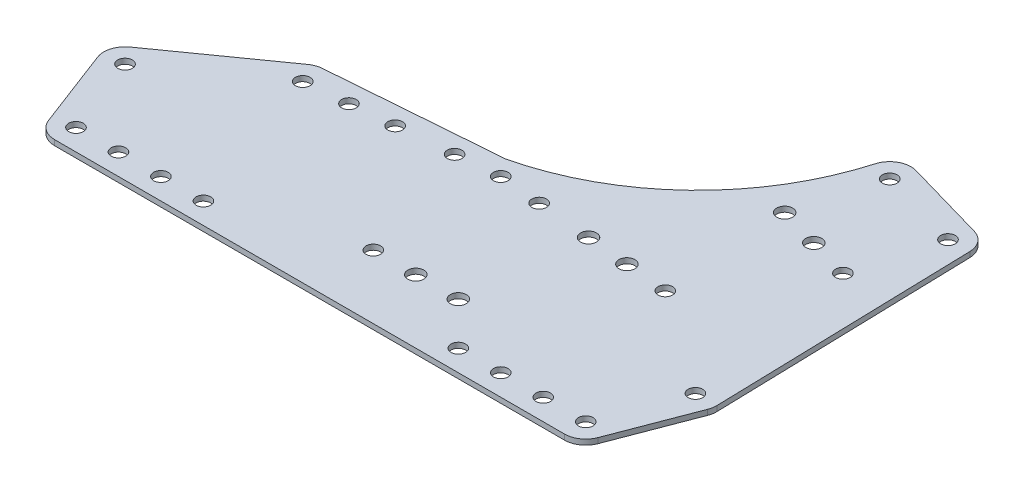
from build123d import *

# Parameters (mm, degrees)
SKETCH1_R           = 2.1828125
SKETCH1_R_2         = 2.38125
BOSS_EXTRUDE1_DEPTH = 1.5875


with BuildPart() as part:
    # Sketch1 → Boss-Extrude1 (new body)
    with BuildSketch(Plane(origin=(0, 0, 0), x_dir=(1, 0, 0), z_dir=(0, 1, 0))):
        with BuildLine():
            Line((-76.2, -19.05), (76.2, -19.05))
            ThreePointArc((76.2, -19.05), (79.801136223, -17.930135553), (82.132104124, -14.965533197))
            Line((82.132104124, -14.965533197), (91.194236912, 8.762883297))
            ThreePointArc((91.194236912, 8.762883297), (91.521572666, 9.959813472), (91.609879929, 11.197550265))
            Line((91.609879929, 11.197550265), (89.542716066, 88.780125789))
            ThreePointArc((89.542716066, 88.780125789), (88.21446111, 92.500361917), (84.943711156, 94.715449457))
            Line((84.943711156, 94.715449457), (60.525881406, 101.710418382))
            ThreePointArc((60.525881406, 101.710418382), (55.697183415, 101.159011684), (52.672681737, 97.354703175))
            ThreePointArc((52.672681737, 97.354703175), (31.779047976, 62.743000168), (-3.710967925, 43.378788638))
            Line((-3.710967925, 43.378788638), (-54.689770483, 39.419061875))
            ThreePointArc((-54.689770483, 39.419061875), (-56.360545493, 39.058557607), (-57.874640982, 38.265483014))
            Line((-57.874640982, 38.265483014), (-88.938751905, 16.205768315))
            ThreePointArc((-88.938751905, 16.205768315), (-91.339222957, 12.870012291), (-91.194236912, 8.762883297))
            Line((-91.194236912, 8.762883297), (-82.132104124, -14.965533197))
            ThreePointArc((-82.132104124, -14.965533197), (-79.801136223, -17.930135553), (-76.2, -19.05))
        make_face()
        with Locations(Location((0, 0, 0), (0, 0, 270))):
            Circle(SKETCH1_R, mode=Mode.SUBTRACT)
        with Locations(Location((12.7, 0, 0), (0, 0, 270))):
            Circle(SKETCH1_R_2, mode=Mode.SUBTRACT)
        with Locations(Location((25.4, 0, 0), (0, 0, 270))):
            Circle(SKETCH1_R_2, mode=Mode.SUBTRACT)
        with Locations(Location((-38.1, -12.7, 0), (0, 0, 270))):
            Circle(SKETCH1_R, mode=Mode.SUBTRACT)
        with Locations(Location((-50.8, -12.7, 0), (0, 0, 270))):
            Circle(SKETCH1_R, mode=Mode.SUBTRACT)
        with Locations(Location((-63.5, -12.7, 0), (0, 0, 270))):
            Circle(SKETCH1_R, mode=Mode.SUBTRACT)
        with Locations(Location((-76.2, -12.7, 0), (0, 0, 270))):
            Circle(SKETCH1_R, mode=Mode.SUBTRACT)
        with Locations(Location((38.1, -12.7, 0), (0, 0, 270))):
            Circle(SKETCH1_R, mode=Mode.SUBTRACT)
        with Locations(Location((50.8, -12.7, 0), (0, 0, 270))):
            Circle(SKETCH1_R, mode=Mode.SUBTRACT)
        with Locations(Location((63.5, -12.7, 0), (0, 0, 270))):
            Circle(SKETCH1_R, mode=Mode.SUBTRACT)
        with Locations(Location((76.2, -12.7, 0), (0, 0, 270))):
            Circle(SKETCH1_R, mode=Mode.SUBTRACT)
        with Locations(Location((-54.198021866, 33.088131193, 0), (0, 0, 270))):
            Circle(SKETCH1_R, mode=Mode.SUBTRACT)
        with Locations(Location((54.198021866, 33.088131193, 0), (0, 0, 270))):
            Circle(SKETCH1_R, mode=Mode.SUBTRACT)
        with Locations(Location((-85.262132788, 11.028416494, 0), (0, 0, 270))):
            Circle(SKETCH1_R, mode=Mode.SUBTRACT)
        with Locations(Location((85.262132788, 11.028416494, 0), (0, 0, 270))):
            Circle(SKETCH1_R, mode=Mode.SUBTRACT)
        with Locations(Location((0, 38.1, 0), (0, 0, 270))):
            Circle(SKETCH1_R, mode=Mode.SUBTRACT)
        with Locations(Location((12.646044992, 36.930578751, 0), (0, 0, 270))):
            Circle(SKETCH1_R, mode=Mode.SUBTRACT)
        with Locations(Location((-12.646044992, 36.930578751, 0), (0, 0, 270))):
            Circle(SKETCH1_R, mode=Mode.SUBTRACT)
        with Locations(Location((41.551976873, 34.257552442, 0), (0, 0, 270))):
            Circle(SKETCH1_R_2, mode=Mode.SUBTRACT)
        with Locations(Location((28.905931881, 35.426973691, 0), (0, 0, 270))):
            Circle(SKETCH1_R_2, mode=Mode.SUBTRACT)
        with Locations(Location((76.2, 64.193162268, 0), (0, 0, 270))):
            Circle(SKETCH1_R, mode=Mode.SUBTRACT)
        with Locations(Location((51.782170249, 71.188131193, 0), (0, 0, 270))):
            Circle(SKETCH1_R_2, mode=Mode.SUBTRACT)
        with Locations(Location((63.991085125, 67.690646731, 0), (0, 0, 270))):
            Circle(SKETCH1_R_2, mode=Mode.SUBTRACT)
        with Locations(Location((-41.551976873, 34.257552442, 0), (0, 0, 270))):
            Circle(SKETCH1_R, mode=Mode.SUBTRACT)
        with Locations(Location((-28.905931881, 35.426973691, 0), (0, 0, 270))):
            Circle(SKETCH1_R, mode=Mode.SUBTRACT)
        with Locations(Location((58.777139174, 95.605960944, 0), (0, 0, 270))):
            Circle(SKETCH1_R, mode=Mode.SUBTRACT)
        with Locations(Location((83.194968925, 88.610992019, 0), (0, 0, 270))):
            Circle(SKETCH1_R, mode=Mode.SUBTRACT)
    extrude(amount=BOSS_EXTRUDE1_DEPTH)


solid = part.part
